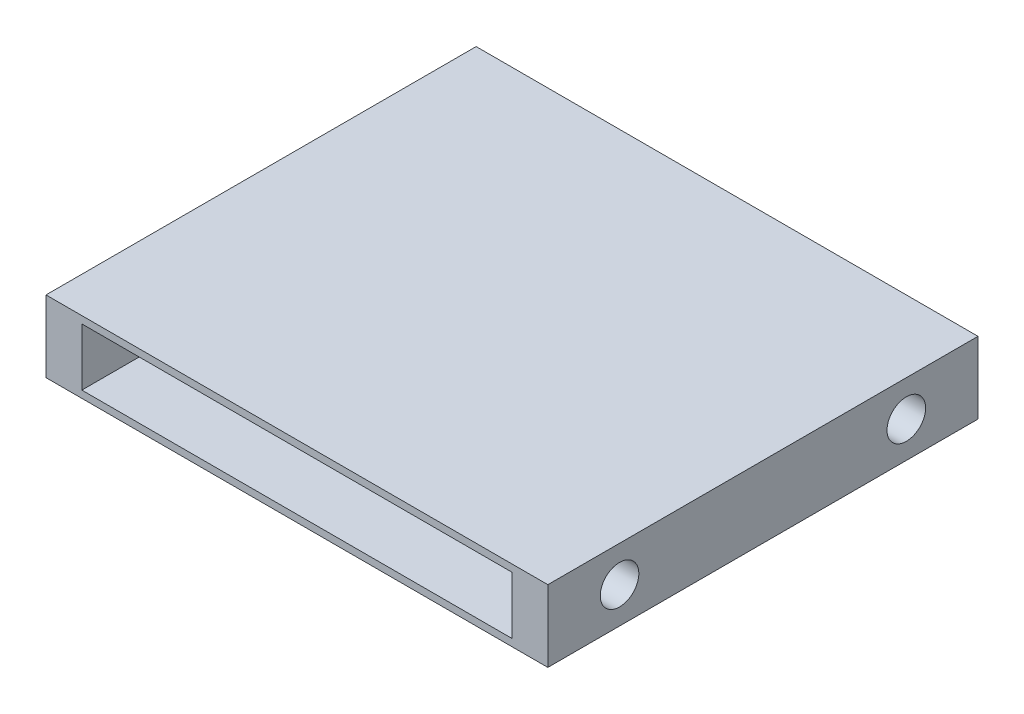
from build123d import *

# Parameters (mm, degrees)
SKETCH1_W               = 70
SKETCH1_H               = 60
BOSS_EXTRUDE1_DEPTH     = 10
SKETCH2_W               = 60
SKETCH2_H               = 8
CUT_EXTRUDE1_DEPTH      = 55
SKETCH3_R               = 2.68983582
CUT_EXTRUDE2_DEPTH      = 55
MIRROR2_COPY_1_SKETCH_R = 2.68983582
MIRROR2_COPY_1_DEPTH    = 55


with BuildPart() as part:
    # Sketch1 → Boss-Extrude1 (new body)
    with BuildSketch(Plane(origin=(0, 0, 0), x_dir=(1, 0, 0), z_dir=(0, 1, 0))):
        with Locations((35, -30)):
            Rectangle(SKETCH1_W, SKETCH1_H)
    extrude(amount=BOSS_EXTRUDE1_DEPTH)

    # Sketch2 → Cut-Extrude1 (cut)
    with BuildSketch(Plane.XY.offset(60)):
        with Locations((35, 5)):
            Rectangle(SKETCH2_W, SKETCH2_H)
    extrude(amount=-CUT_EXTRUDE1_DEPTH, mode=Mode.SUBTRACT)

    # Sketch3 → Cut-Extrude2 (cut)
    with BuildSketch(Plane.ZY.offset(-65)):
        with Locations((10, 5)):
            Circle(SKETCH3_R)
    cut_extrude2 = extrude(amount=-CUT_EXTRUDE2_DEPTH, mode=Mode.SUBTRACT)

    # Mirror1: Cut-Extrude2 across plane
    add(cut_extrude2.mirror(Plane.ZY.offset(-35)), mode=Mode.SUBTRACT)

    # Mirror2: Cut-Extrude2 across plane
    add(cut_extrude2.mirror(Plane.XY.offset(30)), mode=Mode.SUBTRACT)

    # Mirror2 copy 1 sketch → Mirror2 copy 1 (cut)
    with BuildSketch(Plane(origin=(5, 0, 60), x_dir=(0, 0, -1), z_dir=(1, 0, 0))):
        with Locations((10, 5)):
            Circle(MIRROR2_COPY_1_SKETCH_R)
    extrude(amount=-MIRROR2_COPY_1_DEPTH, mode=Mode.SUBTRACT)


solid = part.part
